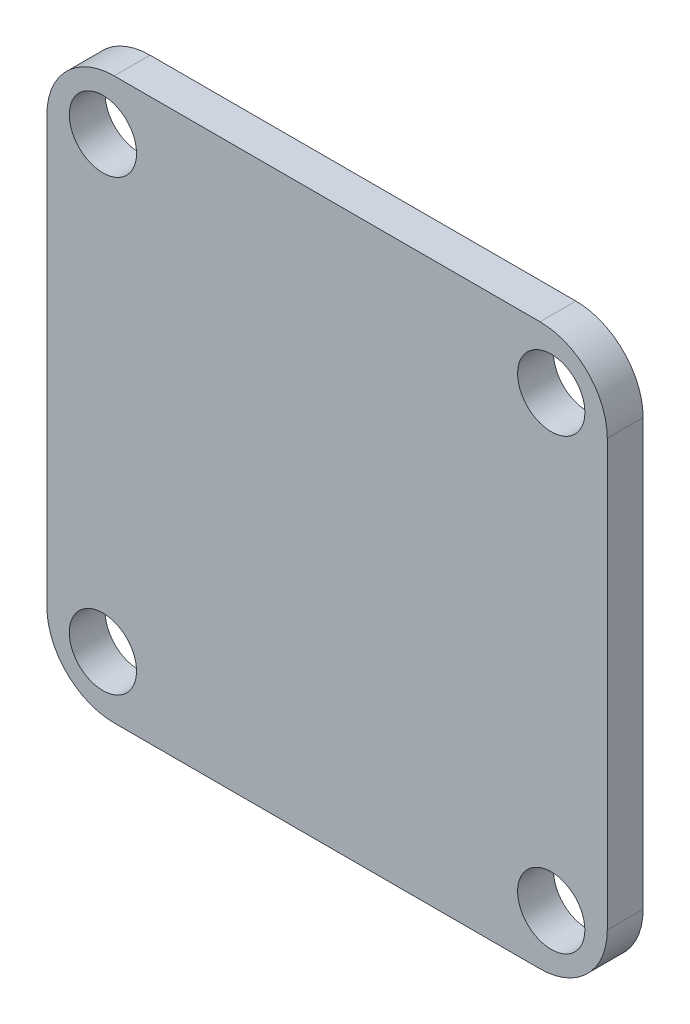
from build123d import *

# Parameters (mm, degrees)
SKETCH1_R           = 1.5
BOSS_EXTRUDE1_DEPTH = 1.6


with BuildPart() as part:
    # Sketch1 → Boss-Extrude1 (new body)
    with BuildSketch(Plane.XY):
        with BuildLine():
            Line((-9.5, -12.5), (9.5, -12.5))
            ThreePointArc((9.5, -12.5), (11.621320344, -11.621320344), (12.5, -9.5))
            Line((12.5, -9.5), (12.5, 9.5))
            ThreePointArc((12.5, 9.5), (11.621320344, 11.621320344), (9.5, 12.5))
            Line((9.5, 12.5), (-9.5, 12.5))
            ThreePointArc((-9.5, 12.5), (-11.621320344, 11.621320344), (-12.5, 9.5))
            Line((-12.5, 9.5), (-12.5, -9.5))
            ThreePointArc((-12.5, -9.5), (-11.621320344, -11.621320344), (-9.5, -12.5))
        make_face()
        with Locations((-10, 10)):
            Circle(SKETCH1_R, mode=Mode.SUBTRACT)
        with Locations(Location((10, 10, 0), (0, 0, 180))):
            Circle(SKETCH1_R, mode=Mode.SUBTRACT)
        with Locations((10, -10)):
            Circle(SKETCH1_R, mode=Mode.SUBTRACT)
        with Locations(Location((-10, -10, 0), (0, 0, 180))):
            Circle(SKETCH1_R, mode=Mode.SUBTRACT)
    extrude(amount=BOSS_EXTRUDE1_DEPTH)


solid = part.part
